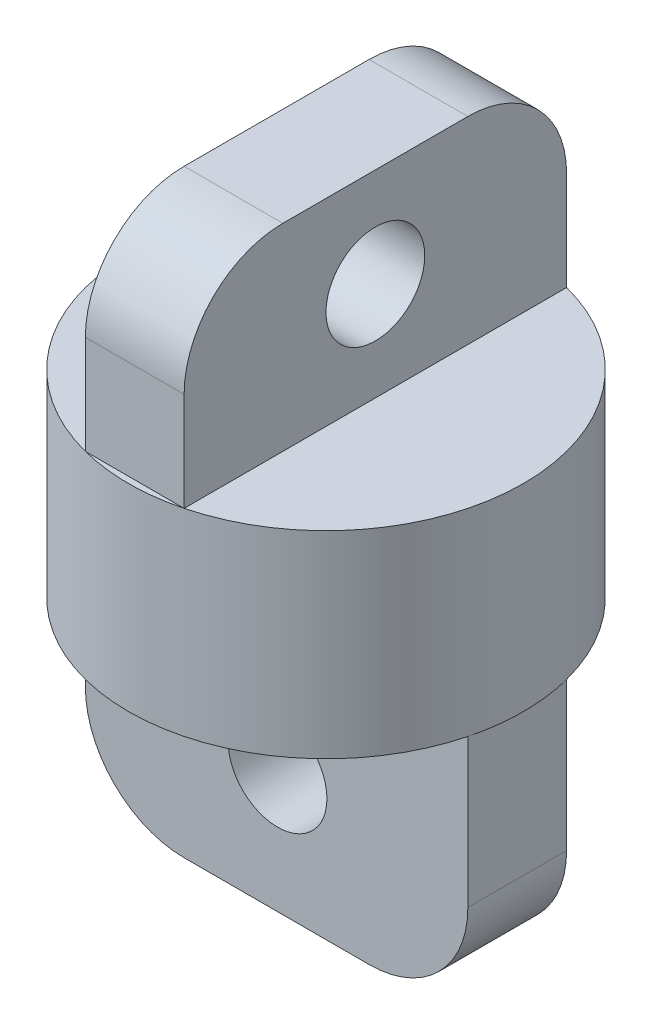
from build123d import *

# Parameters (mm, degrees)
SKETCH1_R           = 50.8
BOSS_EXTRUDE1_DEPTH = 50.8
SKETCH3_W           = 98.373776994
SKETCH3_H           = 25.4
BOSS_EXTRUDE3_DEPTH = 63.5
SKETCH4_R           = 12.7
CUT_EXTRUDE1_DEPTH  = 104.175287739
FILLET1_R           = 25.4
FILLET2_R           = 25.4
SKETCH5_W           = 25.4
SKETCH5_H           = 98.373776994
BOSS_EXTRUDE4_DEPTH = 50.8
SKETCH6_R           = 12.7
CUT_EXTRUDE2_DEPTH  = 50.8
FILLET3_R           = 25.4


with BuildPart() as part:
    # Sketch1 → Boss-Extrude1 (new body)
    with BuildSketch(Plane(origin=(0, 0, 0), x_dir=(1, 0, 0), z_dir=(0, 1, 0))):
        with Locations(Location((0, 0, 0), (0, 0, 270))):
            Circle(SKETCH1_R)
    extrude(amount=BOSS_EXTRUDE1_DEPTH)

    # Sketch3 → Boss-Extrude3 (add)
    with BuildSketch(Plane.XZ):
        Rectangle(SKETCH3_W, SKETCH3_H)
    extrude(amount=BOSS_EXTRUDE3_DEPTH)

    # Sketch4 → Cut-Extrude1 (cut, through all)
    with BuildSketch(Plane.XY.offset(12.7)):
        with Locations((0.243990196, -31.967064289)):
            Circle(SKETCH4_R)
    extrude(amount=-CUT_EXTRUDE1_DEPTH, mode=Mode.SUBTRACT)

    # Fillet1
    fillet1_edges = [part.edges().sort_by_distance(p)[0] for p in [
        (-49.186888497, -63.5, 0),
    ]]
    fillet(fillet1_edges, radius=FILLET1_R)

    # Fillet2
    fillet2_edges = [part.edges().sort_by_distance(p)[0] for p in [
        (49.186888497, -63.5, 0),
    ]]
    fillet(fillet2_edges, radius=FILLET2_R)

    # Sketch5 → Boss-Extrude4 (add)
    with BuildSketch(Plane(origin=(0, 50.8, 0), x_dir=(1, 0, 0), z_dir=(0, 1, 0))):
        Rectangle(SKETCH5_W, SKETCH5_H)
    extrude(amount=BOSS_EXTRUDE4_DEPTH)

    # Sketch6 → Cut-Extrude2 (cut)
    with BuildSketch(Plane(origin=(12.7, 0, 0), x_dir=(0, 0, -1), z_dir=(1, 0, 0))):
        with Locations((0, 76.2)):
            Circle(SKETCH6_R)
    extrude(amount=-CUT_EXTRUDE2_DEPTH, mode=Mode.SUBTRACT)

    # Fillet3
    fillet3_edges = [part.edges().sort_by_distance(p)[0] for p in [
        (0, 101.6, -49.186888497),
        (0, 101.6, 49.186888497),
    ]]
    fillet(fillet3_edges, radius=FILLET3_R)


solid = part.part
